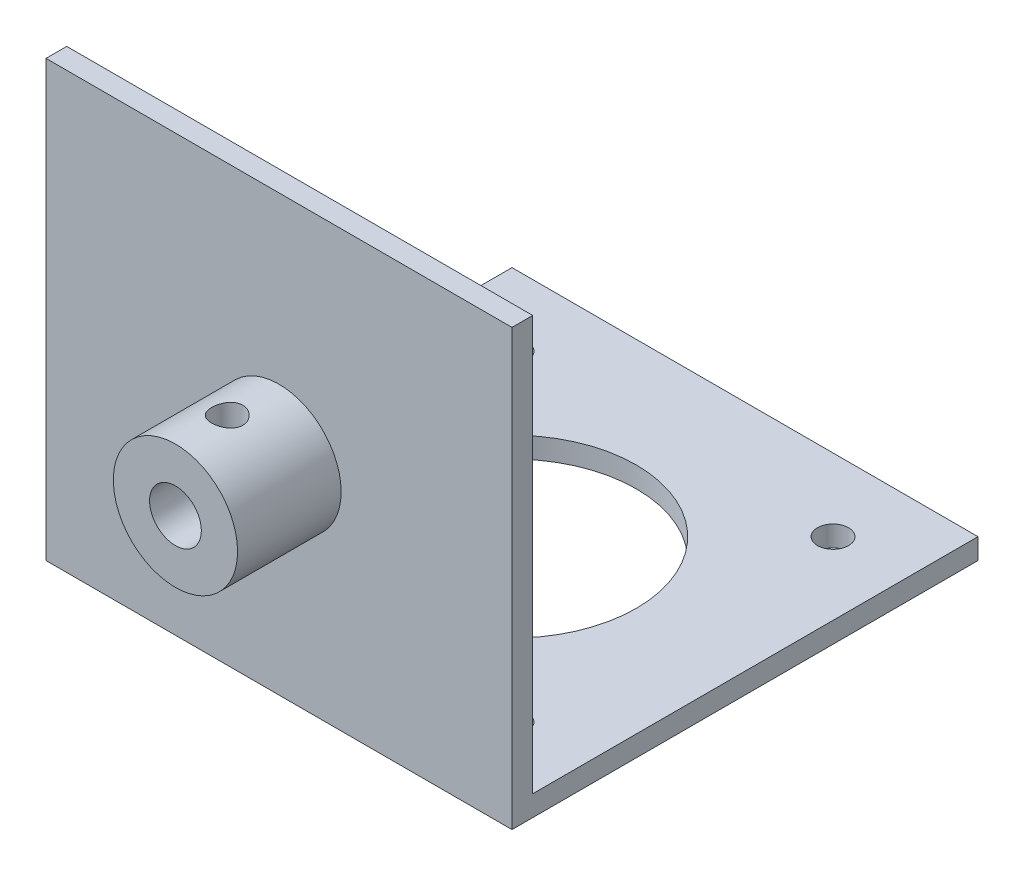
from build123d import *

# Parameters (mm, degrees)
SKETCH_1_W               = 45
SKETCH_1_H               = 45
EXTRUDE_1_DEPTH          = 2
SKETCH_3_R               = 12
SKETCH_3_R_2             = 1.5
CUT_EXTRUDE_1_DEPTH      = 10
SKETCH_7_W               = 45
SKETCH_7_H               = 2
EXTRUDE_3_DEPTH          = 40
SKETCH_8_R               = 6
SKETCH_8_R_2             = 2.5
EXTRUDE_4_DEPTH          = 10
CUT_EXTRUDE_2_DEPTH      = 77.249590163
CUT_EXTRUDE_2_DEPTH_BACK = 77.249590163
SKETCH_9_R               = 1.5


with BuildPart() as part:
    # 草图1 → 凸台-拉伸1 (new body)
    with BuildSketch(Plane(origin=(0, 0, 0), x_dir=(1, 0, 0), z_dir=(0, 1, 0))):
        with Locations((22.5, 22.5)):
            Rectangle(SKETCH_1_W, SKETCH_1_H)
    extrude(amount=EXTRUDE_1_DEPTH)

    # 草图3 → 切除-拉伸1 (cut)
    with BuildSketch(Plane(origin=(0, 2, 0), x_dir=(1, 0, 0), z_dir=(0, 1, 0))):
        with Locations(Location((22.5, 22.5, 0), (0, 0, 270))):
            Circle(SKETCH_3_R)
        with Locations(Location((38, 38, 0), (0, 0, 270))):
            Circle(SKETCH_3_R_2)
        with Locations(Location((7, 38, 0), (0, 0, 270))):
            Circle(SKETCH_3_R_2)
        with Locations(Location((7, 7, 0), (0, 0, 270))):
            Circle(SKETCH_3_R_2)
        with Locations(Location((38, 7, 0), (0, 0, 270))):
            Circle(SKETCH_3_R_2)
    extrude(amount=-CUT_EXTRUDE_1_DEPTH, mode=Mode.SUBTRACT)

    # 草图7 → 凸台-拉伸3 (add)
    with BuildSketch(Plane(origin=(0, 2, 0), x_dir=(1, 0, 0), z_dir=(0, 1, 0))):
        with Locations((22.5, 1)):
            Rectangle(SKETCH_7_W, SKETCH_7_H)
    extrude(amount=EXTRUDE_3_DEPTH)

    # 草图8 → 凸台-拉伸4 (add)
    with BuildSketch(Plane.XY):
        with Locations((22.5, 20)):
            Circle(SKETCH_8_R)
        with Locations((22.5, 20)):
            Circle(SKETCH_8_R_2, mode=Mode.SUBTRACT)
    extrude(amount=EXTRUDE_4_DEPTH)

    # 草图9 → 切除-拉伸2 (cut, two sides: drawn at the far end of the back side and taken through both)
    with BuildSketch(Plane(origin=(0, 0, 0), x_dir=(1, 0, 0), z_dir=(0, 1, 0)).offset(-CUT_EXTRUDE_2_DEPTH_BACK)):
        with Locations(Location((22.5, -5, 0), (0, 0, 270))):
            Circle(SKETCH_9_R)
    extrude(amount=CUT_EXTRUDE_2_DEPTH + CUT_EXTRUDE_2_DEPTH_BACK, mode=Mode.SUBTRACT)


solid = part.part
